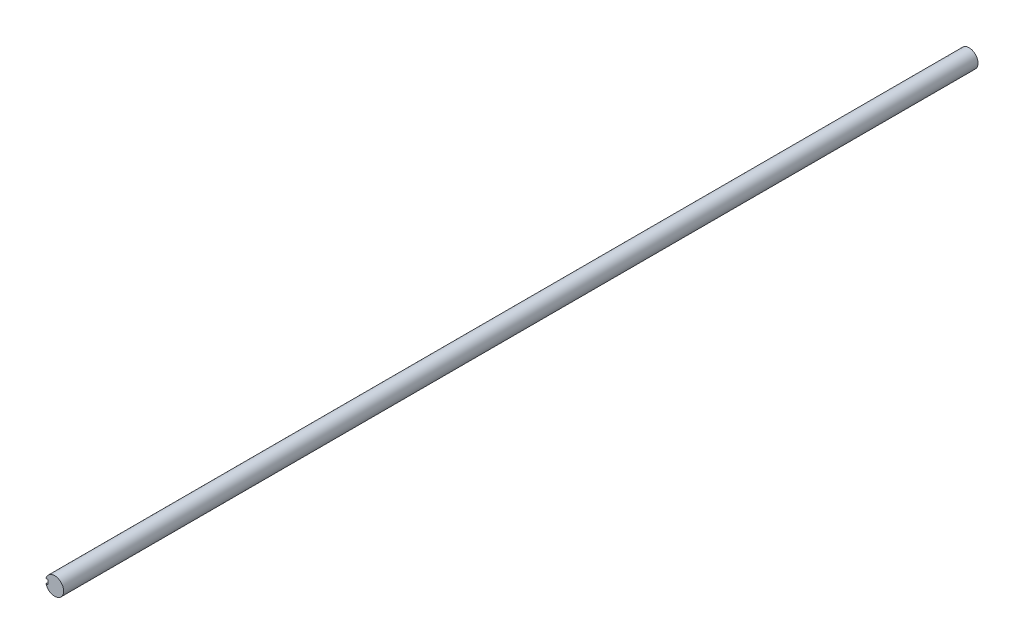
from build123d import *

# Parameters (mm, degrees)
BOSS_EXTRUDE1_DEPTH = 486.69575


with BuildPart() as part:
    # Sketch1 → Boss-Extrude1 (new body)
    with BuildSketch(Plane.XY):
        with BuildLine():
            Line((-4.611270797, 1.190625), (-3.571875, 1.190625))
            Line((-3.571875, 1.190625), (-3.571875, -1.190625))
            Line((-3.571875, -1.190625), (-4.611270797, -1.190625))
            ThreePointArc((-4.611270797, -1.190625), (4.7625, 0), (-4.611270797, 1.190625))
        make_face()
    extrude(amount=BOSS_EXTRUDE1_DEPTH)


solid = part.part
